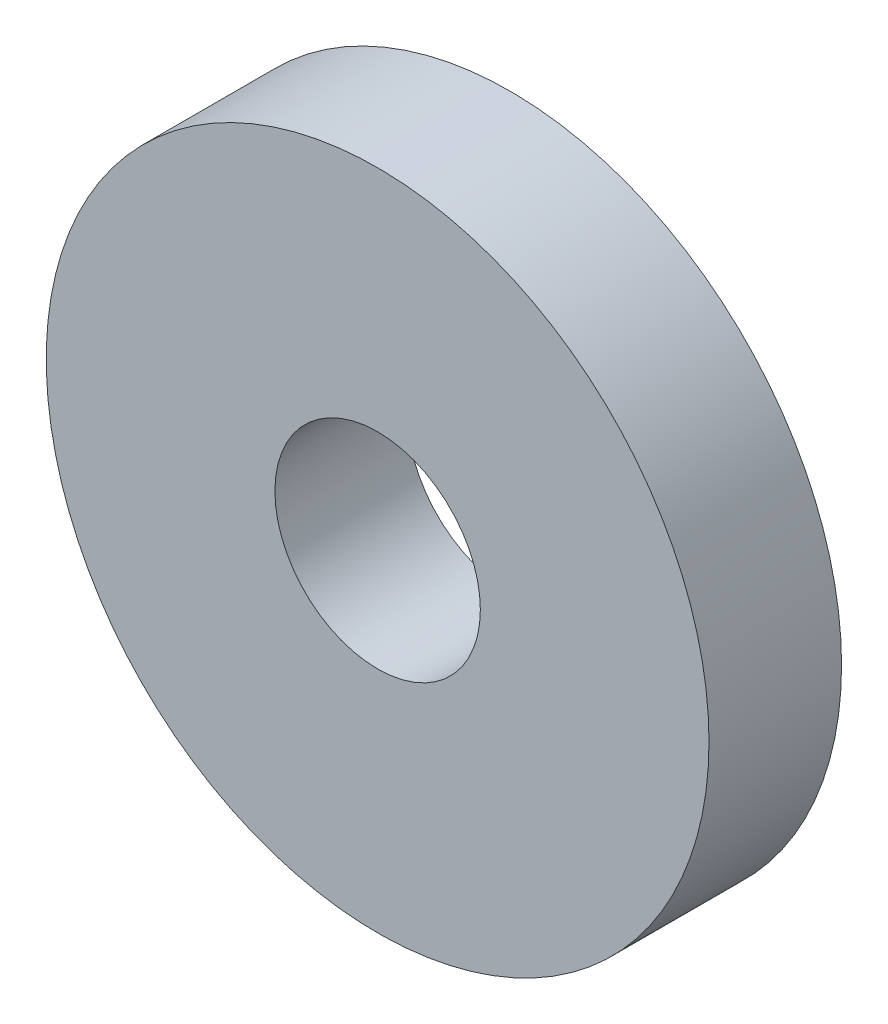
from build123d import *

# Parameters (mm, degrees)
SKETCH_1_R              = 25
EXTRUDE_1_DEPTH         = 10
HOLE_WIZARD_M18_1_D     = 15.5
HOLE_WIZARD_M18_1_DEPTH = 43.5
HOLE_WIZARD_M18_1_TIP   = 4.656669797
HOLE_WIZARD_M6_1_D      = 5
HOLE_WIZARD_M6_1_DEPTH  = 5
HOLE_WIZARD_M6_1_TIP    = 1.502151548


with BuildPart() as part:
    # 草图1 → 凸台-拉伸1 (new body)
    with BuildSketch(Plane.XY):
        Circle(SKETCH_1_R)
    extrude(amount=EXTRUDE_1_DEPTH)

    # M18 螺纹孔1
    with Locations(Plane(origin=(0, 0, 0), x_dir=(-1, 0, 0), z_dir=(0, 0, -1))):
        with Locations((0, 0)):
            Hole(HOLE_WIZARD_M18_1_D / 2, depth=HOLE_WIZARD_M18_1_DEPTH)
            with Locations((0, 0, -(HOLE_WIZARD_M18_1_DEPTH + HOLE_WIZARD_M18_1_TIP / 2))):  # 118° drill point
                Cone(0, HOLE_WIZARD_M18_1_D / 2, HOLE_WIZARD_M18_1_TIP, mode=Mode.SUBTRACT)

    # M6 螺纹孔1
    with Locations(Plane(origin=(0, 0, 0), x_dir=(-1, 0, 0), z_dir=(0, 0, -1))):
        with Locations((0, 18), (-18, 0), (18, 0), (0, -18)):
            Hole(HOLE_WIZARD_M6_1_D / 2, depth=HOLE_WIZARD_M6_1_DEPTH)
            with Locations((0, 0, -(HOLE_WIZARD_M6_1_DEPTH + HOLE_WIZARD_M6_1_TIP / 2))):  # 118° drill point
                Cone(0, HOLE_WIZARD_M6_1_D / 2, HOLE_WIZARD_M6_1_TIP, mode=Mode.SUBTRACT)


solid = part.part
